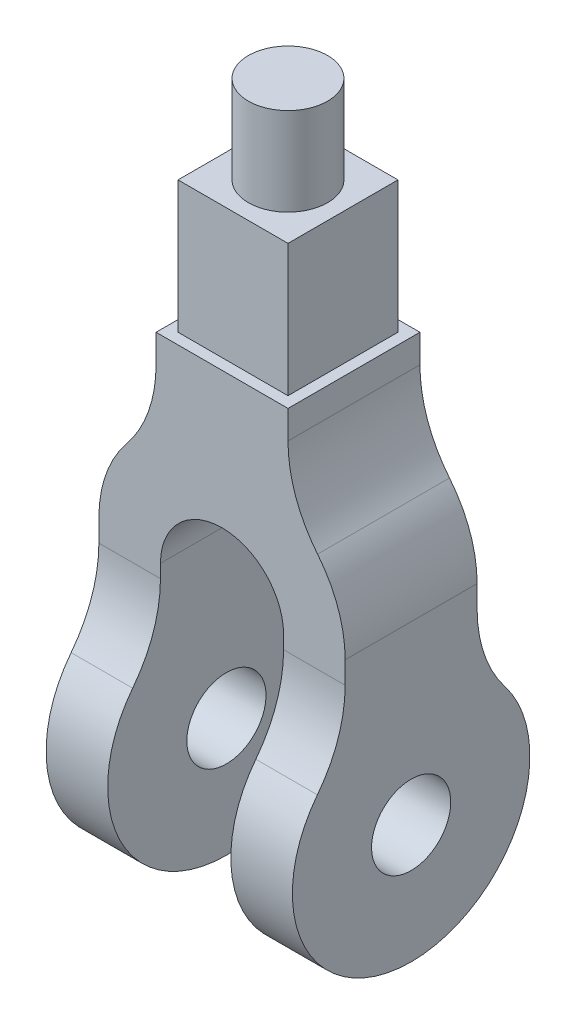
from build123d import *

# Parameters (mm, degrees)
SKETCH1_W           = 56
SKETCH1_H           = 140
BOSS_EXTRUDE1_DEPTH = 54
CUT_EXTRUDE4_DEPTH  = 54
SKETCH5_OUTSIDE_W   = 88.032
SKETCH5_OUTSIDE_H   = 174.032
SKETCH5_OUTSIDE_R   = 9
CUT_EXTRUDE6_DEPTH  = 60
SKETCH6_OUTSIDE_W   = 90.032
SKETCH6_OUTSIDE_H   = 88.032
SKETCH6_OUTSIDE_W_2 = 25
SKETCH6_OUTSIDE_H_2 = 25
CUT_EXTRUDE7_DEPTH  = 30
SKETCH7_R           = 9
BOSS_EXTRUDE2_DEPTH = 20


with BuildPart() as part:
    # Sketch1 → Boss-Extrude1 (new body)
    with BuildSketch(Plane.XY):
        with Locations((-37.333333333, -27.333333333)):
            Rectangle(SKETCH1_W, SKETCH1_H)
    extrude(amount=BOSS_EXTRUDE1_DEPTH)

    # Sketch2 → Cut-Extrude4 (cut)
    with BuildSketch(Plane.XY.offset(54)):
        with BuildLine():
            Line((-52.333333333, 6.259015594), (-52.333333333, 42.666666667))
            Line((-52.333333333, 42.666666667), (-65.333333333, 42.666666667))
            Line((-65.333333333, 42.666666667), (-65.333333333, -30.333333244))
            ThreePointArc((-65.333333333, -30.333333244), (-63.717759237, -20.959856403), (-59.057471264, -12.668061438))
            ThreePointArc((-59.057471264, -12.668061438), (-54.064305564, -3.783995357), (-52.333333333, 6.259015594))
        make_face()
        with BuildLine():
            Line((-37.333333333, -97.333333333), (-37.333333333, -18.333333333))
            ThreePointArc((-37.333333333, -18.333333333), (-47.23282827, -22.433838397), (-51.333333333, -32.333333333))
            Line((-51.333333333, -32.333333333), (-51.333333333, -54.582044639))
            Line((-51.333333333, -54.582044639), (-51.333333333, -97.333333333))
            Line((-51.333333333, -97.333333333), (-37.333333333, -97.333333333))
        make_face()
        with BuildLine():
            ThreePointArc((-37.333333333, -18.333333333), (-27.433838397, -22.433838397), (-23.333333333, -32.333333333))
            Line((-23.333333333, -32.333333333), (-23.333333333, -97.333333333))
            Line((-23.333333333, -97.333333333), (-9.333333333, -97.333333333))
            Line((-9.333333333, -97.333333333), (-9.333333333, 42.666666667))
            Line((-9.333333333, 42.666666667), (-22.333333333, 42.666666667))
            Line((-22.333333333, 42.666666667), (-37.333333333, 42.666666667))
            Line((-37.333333333, 42.666666667), (-37.333333333, -18.333333333))
        make_face()
        with BuildLine():
            Line((-23.333333333, -97.333333333), (-23.333333333, -32.333333333))
            ThreePointArc((-23.333333333, -32.333333333), (-27.433838397, -22.433838397), (-37.333333333, -18.333333333))
            Line((-37.333333333, -18.333333333), (-37.333333333, -97.333333333))
            Line((-37.333333333, -97.333333333), (-23.333333333, -97.333333333))
        make_face()
    extrude(amount=-CUT_EXTRUDE4_DEPTH, mode=Mode.SUBTRACT)

    # Mirror3: part across plane


with BuildPart() as part_1:
    add(part.part)
    add(part.part.mirror(Plane.ZY.offset(37.333333333)))

    # Sketch5 outside → Cut-Extrude6 (cut)
    # profile 1 of 2: a face of its own
    with BuildSketch(Plane(origin=(-9.333333333, 0, 0), x_dir=(0, 0, -1), z_dir=(1, 0, 0))):
        with Locations((-27, -27.333)):
            Rectangle(SKETCH5_OUTSIDE_W, SKETCH5_OUTSIDE_H)
        with BuildLine():
            Line((-42, 42.666666667), (-12, 42.666666667))
            Line((-12, 42.666666667), (-12, -35.347621964))
            ThreePointArc((-12, -35.347621964), (-10.377159088, -45.080907232), (-5.684210526, -53.761154264))
            ThreePointArc((-5.684210526, -53.761154264), (-27, -97.333333333), (-48.315789474, -53.761154264))
            ThreePointArc((-48.315789474, -53.761154264), (-43.622840912, -45.080907232), (-42, -35.347621964))
            Line((-42, -35.347621964), (-42, 42.666666667))
        make_face(mode=Mode.SUBTRACT)
    # profile 2 of 2: a face of its own
    with BuildSketch(Plane(origin=(-9.333333333, 0, 0), x_dir=(0, 0, -1), z_dir=(1, 0, 0))):
        with Locations(Location((-27, -70.333333333, 0), (0, 0, 90))):
            Circle(SKETCH5_OUTSIDE_R)
    extrude(amount=-CUT_EXTRUDE6_DEPTH, mode=Mode.SUBTRACT)

    # Sketch6 outside → Cut-Extrude7 (cut)
    with BuildSketch(Plane(origin=(0, 42.666666667, 0), x_dir=(1, 0, 0), z_dir=(0, 1, 0))):
        with Locations((-37.333, -27)):
            Rectangle(SKETCH6_OUTSIDE_W, SKETCH6_OUTSIDE_H)
        with Locations((-37.333333333, -27)):
            Rectangle(SKETCH6_OUTSIDE_W_2, SKETCH6_OUTSIDE_H_2, mode=Mode.SUBTRACT)
    extrude(amount=-CUT_EXTRUDE7_DEPTH, mode=Mode.SUBTRACT)

    # Sketch7 → Boss-Extrude2 (add)
    with BuildSketch(Plane(origin=(0, 42.666666667, 0), x_dir=(1, 0, 0), z_dir=(0, 1, 0))):
        with Locations(Location((-37.333333333, -27, 0), (0, 0, 270))):
            Circle(SKETCH7_R)
    extrude(amount=BOSS_EXTRUDE2_DEPTH)


solid = part_1.part
